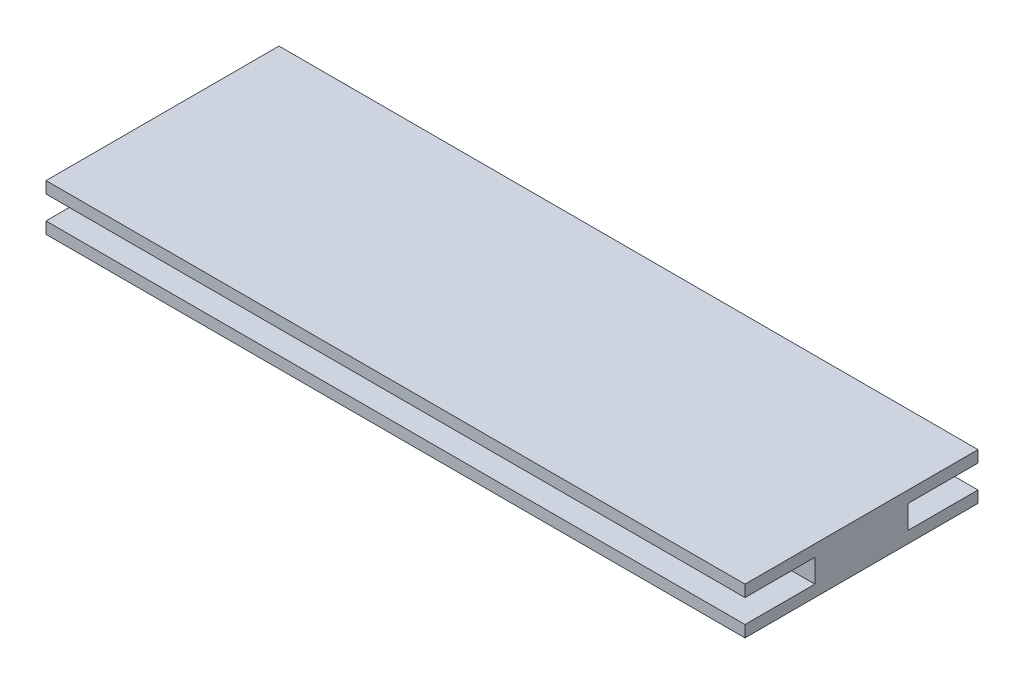
from build123d import *

# Parameters (mm, degrees)
BOSS_EXTRUDE1_DEPTH = 95.25


with BuildPart() as part:
    # Sketch1 → Boss-Extrude1 (new body)
    with BuildSketch(Plane(origin=(0, 0, 0), x_dir=(0, 0, -1), z_dir=(1, 0, 0))):
        Polygon((-15.875, 1.5875), (-15.875, 3.175), (15.875, 3.175), (15.875, 1.5875), (6.35, 1.5875), (6.35, -1.5875), (15.875, -1.5875), (15.875, -3.175), (-15.875, -3.175), (-15.875, -1.5875), (-6.35, -1.5875), (-6.35, 1.5875), align=None)
    extrude(amount=BOSS_EXTRUDE1_DEPTH)


solid = part.part
